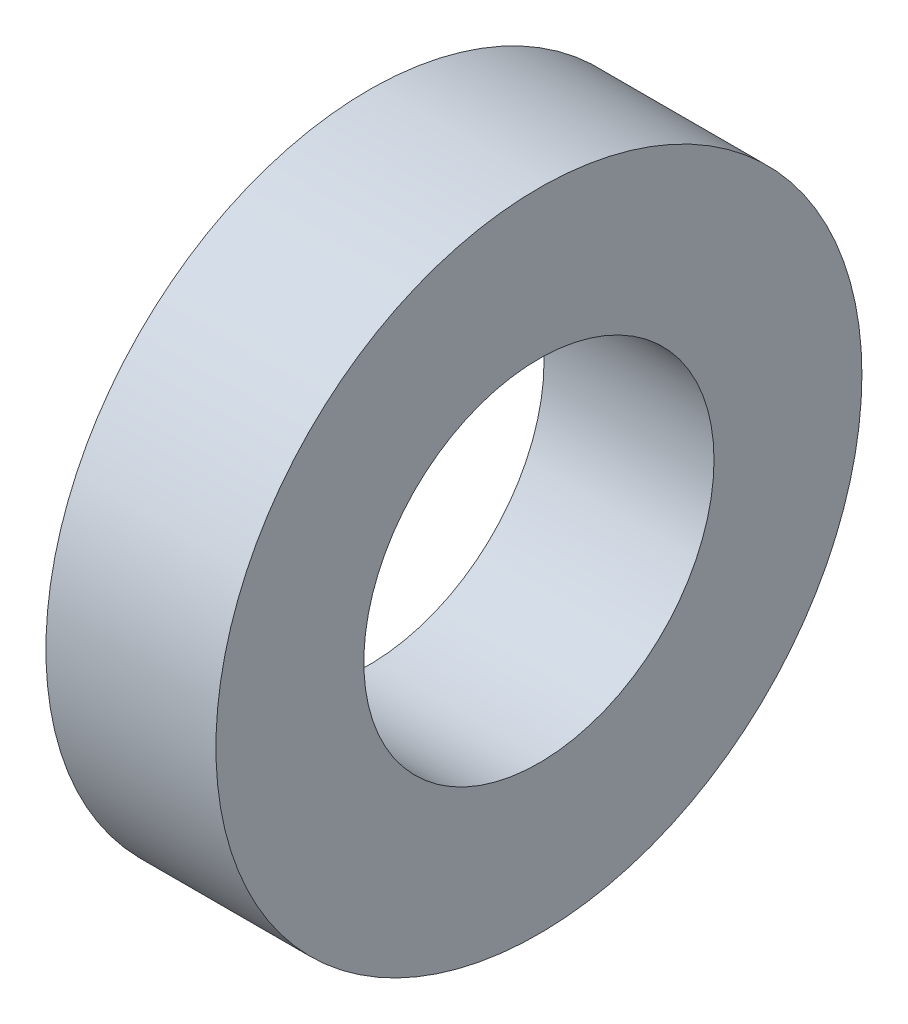
from build123d import *

# Parameters (mm, degrees)
SKETCH1_R           = 47.5
SKETCH1_R_2         = 25.75
BOSS_EXTRUDE1_DEPTH = 25


with BuildPart() as part:
    # Sketch1 → Boss-Extrude1 (new body)
    with BuildSketch(Plane(origin=(0, 0, 0), x_dir=(0, 0, -1), z_dir=(1, 0, 0))):
        Circle(SKETCH1_R)
        Circle(SKETCH1_R_2, mode=Mode.SUBTRACT)
    extrude(amount=BOSS_EXTRUDE1_DEPTH)


solid = part.part
